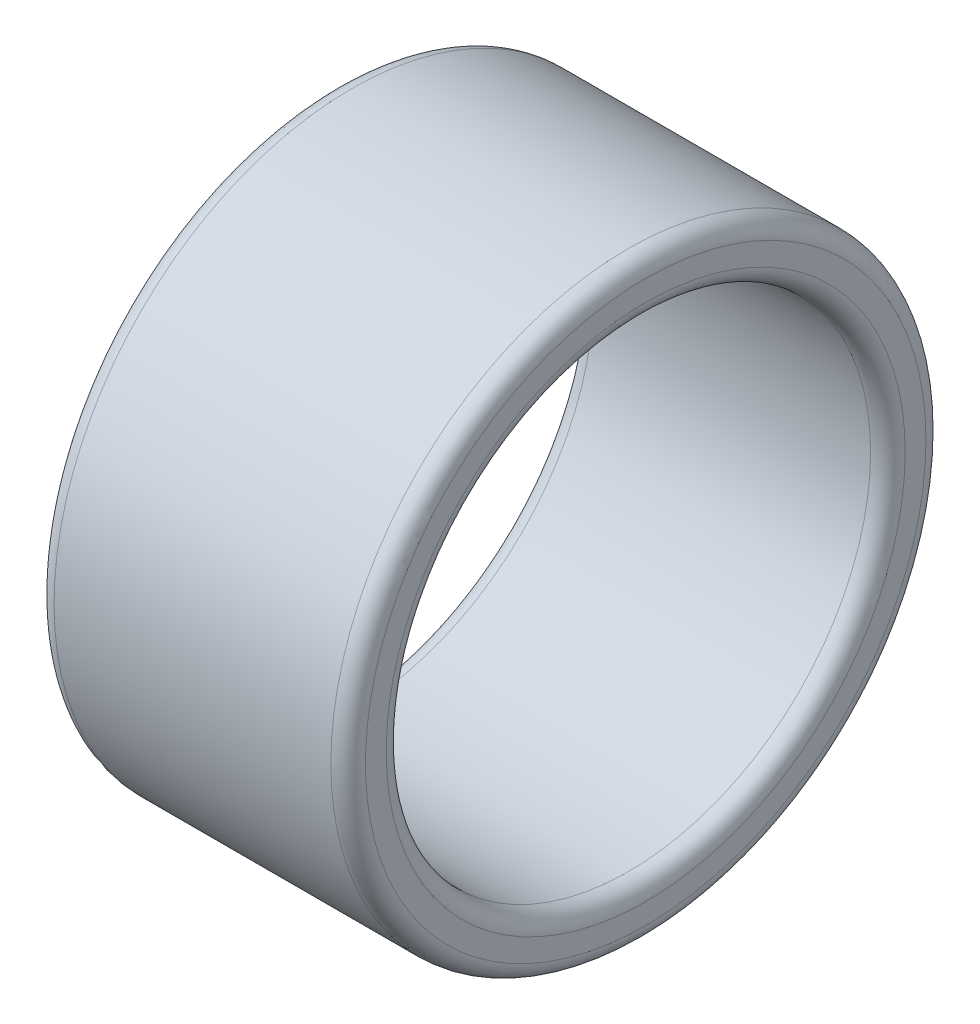
from build123d import *

# Parameters (mm, degrees)
SKETCH2_R           = 34.4
SKETCH2_R_2         = 28
BOSS_EXTRUDE1_DEPTH = 36
FILLET1_R           = 2


with BuildPart() as part:
    # Sketch2 → Boss-Extrude1 (new body)
    with BuildSketch(Plane(origin=(0, 0, 0), x_dir=(0, 0, -1), z_dir=(1, 0, 0))):
        Circle(SKETCH2_R)
        Circle(SKETCH2_R_2, mode=Mode.SUBTRACT)
    extrude(amount=BOSS_EXTRUDE1_DEPTH)

    # Fillet1
    fillet1_edges = [part.edges().sort_by_distance(p)[0] for p in [
        (0, 0, 34.4),
        (36, 0, 34.4),
        (0, 0, 28),
        (36, 0, 28),
    ]]
    fillet(fillet1_edges, radius=FILLET1_R)


solid = part.part
